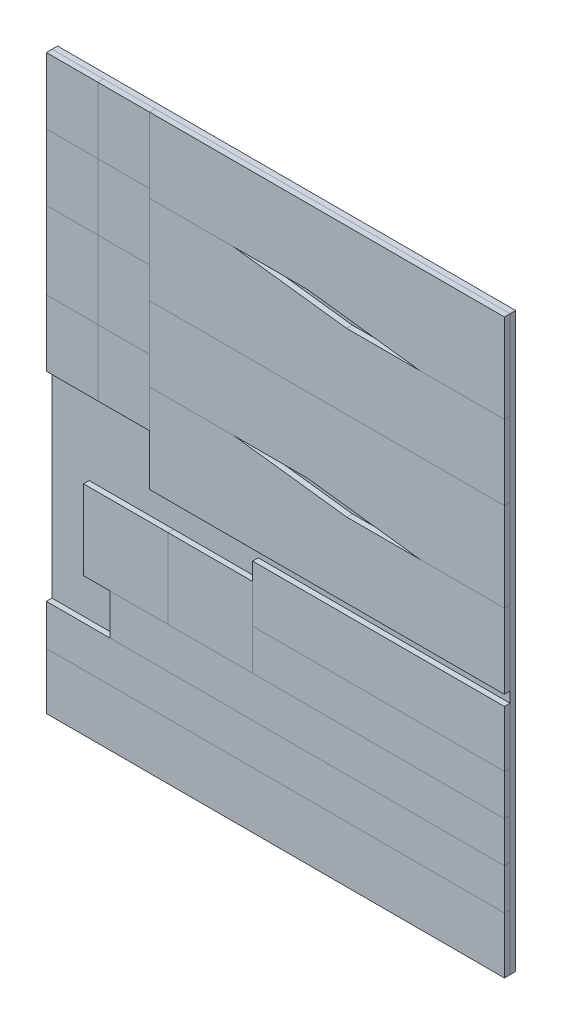
from build123d import *

# Parameters (mm, degrees)
BOSS_EXTRUDE2_DEPTH   = 10
SKETCH1_W             = 91.5
SKETCH1_H             = 117.46
BOSS_EXTRUDE2_2_DEPTH = 10
BOSS_EXTRUDE2_3_DEPTH = 10
SKETCH1_H_2           = 117.44
BOSS_EXTRUDE2_4_DEPTH = 10
SKETCH1_W_2           = 447
SKETCH1_H_3           = 100
BOSS_EXTRUDE2_5_DEPTH = 10
SKETCH1_W_3           = 813
SKETCH1_H_4           = 72.46
BOSS_EXTRUDE2_6_DEPTH = 10
SKETCH1_W_4           = 150
SKETCH1_H_5           = 141.19
BOSS_EXTRUDE2_7_DEPTH = 10
SKETCH1_4_W           = 91.5
SKETCH1_4_H           = 117.46
BOSS_EXTRUDE3_DEPTH   = 10
BOSS_EXTRUDE3_2_DEPTH = 10
SKETCH1_4_H_2         = 137.44
BOSS_EXTRUDE3_3_DEPTH = 10
BOSS_EXTRUDE3_4_DEPTH = 10
SKETCH1_4_W_2         = 813
SKETCH1_4_H_3         = 100
BOSS_EXTRUDE3_5_DEPTH = 10
SKETCH1_4_W_3         = 150
SKETCH1_4_H_4         = 141.19
BOSS_EXTRUDE3_6_DEPTH = 10
SKETCH1_5_W           = 91.5
SKETCH1_5_H           = 117.46
BOSS_EXTRUDE4_DEPTH   = 10
SKETCH1_5_H_2         = 117.44
BOSS_EXTRUDE4_2_DEPTH = 10
SKETCH1_5_W_2         = 447
SKETCH1_5_H_3         = 72.46
BOSS_EXTRUDE4_3_DEPTH = 10
SKETCH1_6_W           = 91.5
SKETCH1_6_H           = 117.46
BOSS_EXTRUDE5_DEPTH   = 10
SKETCH1_6_H_2         = 137.44
BOSS_EXTRUDE5_2_DEPTH = 10
SKETCH1_6_W_2         = 700
SKETCH1_6_H_3         = 72.46
BOSS_EXTRUDE5_3_DEPTH = 10
SKETCH1_8_W           = 813
SKETCH1_8_H           = 1016
BOSS_EXTRUDE6_DEPTH   = 10


with BuildPart() as part:
    # Sketch1 → Boss-Extrude2 (new body)
    with BuildSketch(Plane.XY):
        Polygon((813, 1016), (183, 1016), (183, 883.5), (463, 883.5), (663, 858.5), (813, 858.5), align=None)
    extrude(amount=BOSS_EXTRUDE2_DEPTH)


with BuildPart() as body_2:
    # Sketch1 → Boss-Extrude2 2 (new body)
    with BuildSketch(Plane.XY):
        with Locations((45.75, 839.81)):
            Rectangle(SKETCH1_W, SKETCH1_H)
    extrude(amount=BOSS_EXTRUDE2_2_DEPTH)


with BuildPart() as body_3:
    # Sketch1 → Boss-Extrude2 3 (new body)
    with BuildSketch(Plane.XY):
        Polygon((813, 568.5), (813, 726), (183, 726), (183, 593.5), (463, 593.5), (663, 568.5), align=None)
    extrude(amount=BOSS_EXTRUDE2_3_DEPTH)


with BuildPart() as body_4:
    # Sketch1 → Boss-Extrude2 4 (new body)
    with BuildSketch(Plane.XY):
        with Locations((45.75, 584.92)):
            Rectangle(SKETCH1_W, SKETCH1_H_2)
    extrude(amount=BOSS_EXTRUDE2_4_DEPTH)


with BuildPart() as body_5:
    # Sketch1 → Boss-Extrude2 5 (new body)
    with BuildSketch(Plane.XY):
        with Locations((589.5, 367.38)):
            Rectangle(SKETCH1_W_2, SKETCH1_H_3)
    extrude(amount=BOSS_EXTRUDE2_5_DEPTH)


with BuildPart() as body_6:
    # Sketch1 → Boss-Extrude2 6 (new body)
    with BuildSketch(Plane.XY):
        with Locations((406.5, 136.23)):
            Rectangle(SKETCH1_W_3, SKETCH1_H_4)
    extrude(amount=BOSS_EXTRUDE2_6_DEPTH)


with BuildPart() as body_7:
    # Sketch1 → Boss-Extrude2 7 (new body)
    with BuildSketch(Plane.XY):
        with Locations((141, 315.515)):
            Rectangle(SKETCH1_W_4, SKETCH1_H_5)
    extrude(amount=BOSS_EXTRUDE2_7_DEPTH)


with BuildPart() as body_8:
    # Sketch1<4> → Boss-Extrude3 (new body)
    with BuildSketch(Plane.XY):
        with Locations((45.75, 957.27)):
            Rectangle(SKETCH1_4_W, SKETCH1_4_H)
    extrude(amount=BOSS_EXTRUDE3_DEPTH)


with BuildPart() as body_9:
    # Sketch1<4> → Boss-Extrude3 2 (new body)
    with BuildSketch(Plane.XY):
        Polygon((333, 883.5), (183, 883.5), (183, 726), (813, 726), (813, 858.5), (533, 858.5), align=None)
    extrude(amount=BOSS_EXTRUDE3_2_DEPTH)


with BuildPart() as body_10:
    # Sketch1<4> → Boss-Extrude3 3 (new body)
    with BuildSketch(Plane.XY):
        with Locations((45.75, 712.36)):
            Rectangle(SKETCH1_4_W, SKETCH1_4_H_2)
    extrude(amount=BOSS_EXTRUDE3_3_DEPTH)


with BuildPart() as body_11:
    # Sketch1<4> → Boss-Extrude3 4 (new body)
    with BuildSketch(Plane.XY):
        Polygon((813, 436), (813, 568.5), (533, 568.5), (333, 593.5), (183, 593.5), (183, 436), align=None)
    extrude(amount=BOSS_EXTRUDE3_4_DEPTH)


with BuildPart() as body_12:
    # Sketch1<4> → Boss-Extrude3 5 (new body)
    with BuildSketch(Plane.XY):
        with Locations((406.5, 50)):
            Rectangle(SKETCH1_4_W_2, SKETCH1_4_H_3)
    extrude(amount=BOSS_EXTRUDE3_5_DEPTH)


with BuildPart() as body_13:
    # Sketch1<4> → Boss-Extrude3 6 (new body)
    with BuildSketch(Plane.XY):
        with Locations((291, 315.515)):
            Rectangle(SKETCH1_4_W_3, SKETCH1_4_H_4)
    extrude(amount=BOSS_EXTRUDE3_6_DEPTH)


with BuildPart() as body_14:
    # Sketch1<5> → Boss-Extrude4 (new body)
    with BuildSketch(Plane.XY):
        with Locations((137.25, 839.81)):
            Rectangle(SKETCH1_5_W, SKETCH1_5_H)
    extrude(amount=BOSS_EXTRUDE4_DEPTH)


with BuildPart() as body_15:
    # Sketch1<5> → Boss-Extrude4 2 (new body)
    with BuildSketch(Plane.XY):
        with Locations((137.25, 584.92)):
            Rectangle(SKETCH1_5_W, SKETCH1_5_H_2)
    extrude(amount=BOSS_EXTRUDE4_2_DEPTH)


with BuildPart() as body_16:
    # Sketch1<5> → Boss-Extrude4 3 (new body)
    with BuildSketch(Plane.XY):
        with Locations((589.5, 281.15)):
            Rectangle(SKETCH1_5_W_2, SKETCH1_5_H_3)
    extrude(amount=BOSS_EXTRUDE4_3_DEPTH)


with BuildPart() as body_17:
    # Sketch1<6> → Boss-Extrude5 (new body)
    with BuildSketch(Plane.XY):
        with Locations((137.25, 957.27)):
            Rectangle(SKETCH1_6_W, SKETCH1_6_H)
    extrude(amount=BOSS_EXTRUDE5_DEPTH)


with BuildPart() as body_18:
    # Sketch1<6> → Boss-Extrude5 2 (new body)
    with BuildSketch(Plane.XY):
        with Locations((137.25, 712.36)):
            Rectangle(SKETCH1_6_W, SKETCH1_6_H_2)
    extrude(amount=BOSS_EXTRUDE5_2_DEPTH)


with BuildPart() as body_19:
    # Sketch1<6> → Boss-Extrude5 3 (new body)
    with BuildSketch(Plane.XY):
        with Locations((463, 208.69)):
            Rectangle(SKETCH1_6_W_2, SKETCH1_6_H_3)
    extrude(amount=BOSS_EXTRUDE5_3_DEPTH)


with BuildPart() as body_20:
    # Sketch1<8> → Boss-Extrude6 (new body)
    with BuildSketch(Plane.XY):
        with Locations((406.5, 508)):
            Rectangle(SKETCH1_8_W, SKETCH1_8_H)
    extrude(amount=-BOSS_EXTRUDE6_DEPTH)


solid = Compound([part.part, body_2.part, body_3.part, body_4.part, body_5.part, body_6.part, body_7.part, body_8.part, body_9.part, body_10.part, body_11.part, body_12.part, body_13.part, body_14.part, body_15.part, body_16.part, body_17.part, body_18.part, body_19.part, body_20.part])
